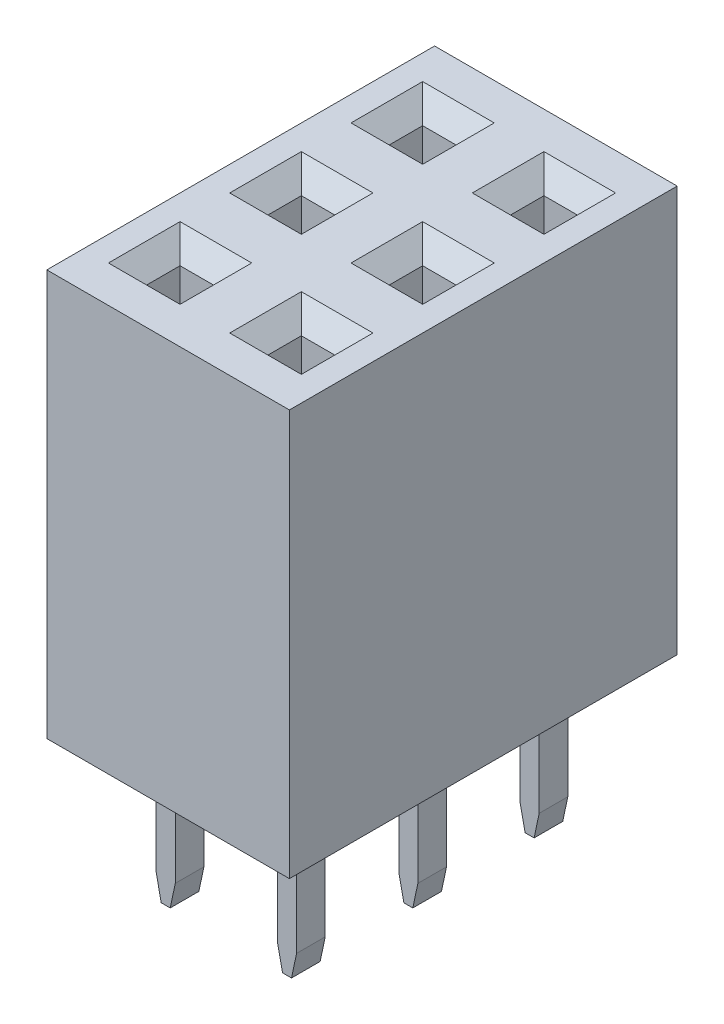
from build123d import *
from OCP.BRepFilletAPI import BRepFilletAPI_MakeChamfer

# Parameters (mm, degrees)
EXTRUDE_1_DEPTH                     = 8.5
SKETCH_4_W                          = 0.7
SKETCH_4_H                          = 0.7
CUT_EXTRUDE_1_DEPTH                 = 8.2
CHAMFER_3_SIZE                      = 0.4
SKETCH_2_W                          = 0.4
SKETCH_2_H                          = 0.6
EXTRUDE_2_DEPTH                     = 3
CHAMFER_2_SIZE                      = 0.5
CHAMFER_2_SIZE2                     = 0.106278281
PATTERN_LINEAR_1_COUNT              = 3
PATTERN_LINEAR_1_PITCH              = 2.54
PATTERN_LINEAR_1_COUNT_DIR2         = 2
PATTERN_LINEAR_1_PITCH_DIR2         = 2.54
CHAMFER_3_OF_PATTERN_LINEAR_1_SIZE  = 0.4
CHAMFER_2_OF_PATTERN_LINEAR_1_SIZE  = 0.5
CHAMFER_2_OF_PATTERN_LINEAR_1_SIZE2 = 0.106278281


with BuildPart() as part:
    # Эскиз1 → Бобышка-Вытянуть1 (new body)
    with BuildSketch(Plane(origin=(0, 0, 0), x_dir=(-1, 0, 0), z_dir=(0, 1, 0))):
        Polygon((-1.27, 1.52), (1.27, 1.52), (3.81, 1.52), (3.81, -1.52), (3.81, -6.6), (-1.27, -6.6), (-1.27, -1.52), align=None)
    extrude(amount=EXTRUDE_1_DEPTH)

    # Эскиз4 → Вырез-Вытянуть1 (cut)
    with BuildSketch(Plane(origin=(0, 8.5, 0), x_dir=(1, 0, 0), z_dir=(0, 1, 0))):
        Rectangle(SKETCH_4_W, SKETCH_4_H)
    cut_extrude_1 = extrude(amount=-CUT_EXTRUDE_1_DEPTH, mode=Mode.SUBTRACT)

    # Фаска3
    chamfer_3_edges = [part.edges().sort_by_distance(p)[0] for p in [
        (-0.35, 8.5, 0),
        (0, 8.5, 0.35),
        (0.35, 8.5, 0),
        (0, 8.5, -0.35),
    ]]
    chamfer(chamfer_3_edges, length=CHAMFER_3_SIZE)

    # Эскиз2 → Бобышка-Вытянуть2 (add)
    with BuildSketch(Plane(origin=(0, 0, 0), x_dir=(-1, 0, 0), z_dir=(0, 1, 0))):
        Rectangle(SKETCH_2_W, SKETCH_2_H)
    extrude_2 = extrude(amount=-EXTRUDE_2_DEPTH)

    # Фаска2: one chamfer whose edges measure the first distance from different faces: ONE call of the kernel's chamfer builder (chamfer() names one face for all edges)
    chamfer_2_edges_1 = [part.edges().sort_by_distance(p)[0] for p in [
        (-0.2, -3, 0),
    ]]
    chamfer_2_side_1 = [part.faces().sort_by_distance(p)[0] for p in [
        (-0.2, -1.5, 0),
    ]]
    chamfer_2_edges_2 = [part.edges().sort_by_distance(p)[0] for p in [
        (0.2, -3, 0),
    ]]
    chamfer_2_side_2 = [part.faces().sort_by_distance(p)[0] for p in [
        (0.2, -1.5, 0),
    ]]
    chamfer_2 = BRepFilletAPI_MakeChamfer(part.part.solid().wrapped)
    for e in chamfer_2_edges_1:
        chamfer_2.Add(CHAMFER_2_SIZE, CHAMFER_2_SIZE2, e.wrapped, chamfer_2_side_1[0].wrapped)  # the first distance lies on this face
    for e in chamfer_2_edges_2:
        chamfer_2.Add(CHAMFER_2_SIZE, CHAMFER_2_SIZE2, e.wrapped, chamfer_2_side_2[0].wrapped)  # the first distance lies on this face
    add(Compound.cast(chamfer_2.Shape()), mode=Mode.REPLACE)

    # Линейный массив1: Вырез-Вытянуть1, Extrude 2 3 × 2
    with Locations(*[(-j * PATTERN_LINEAR_1_PITCH_DIR2, 0, -i * PATTERN_LINEAR_1_PITCH) for i in range(PATTERN_LINEAR_1_COUNT) for j in range(PATTERN_LINEAR_1_COUNT_DIR2) if (i, j) != (0, 0)]):
        add(cut_extrude_1, mode=Mode.SUBTRACT)
        add(extrude_2)

    # Фаска3 of Линейный массив1
    chamfer_3_of_pattern_linear_1_edges = [part.edges().sort_by_distance(p)[0] for p in [
        (-2.89, 8.5, 0),
        (-2.54, 8.5, 0.35),
        (-2.19, 8.5, 0),
        (-2.54, 8.5, -0.35),
        (-0.35, 8.5, -2.54),
        (0, 8.5, -2.19),
        (0.35, 8.5, -2.54),
        (0, 8.5, -2.89),
        (-2.89, 8.5, -2.54),
        (-2.54, 8.5, -2.19),
        (-2.19, 8.5, -2.54),
        (-2.54, 8.5, -2.89),
        (-0.35, 8.5, -5.08),
        (0, 8.5, -4.73),
        (0.35, 8.5, -5.08),
        (0, 8.5, -5.43),
        (-2.89, 8.5, -5.08),
        (-2.54, 8.5, -4.73),
        (-2.19, 8.5, -5.08),
        (-2.54, 8.5, -5.43),
    ]]
    chamfer(chamfer_3_of_pattern_linear_1_edges, length=CHAMFER_3_OF_PATTERN_LINEAR_1_SIZE)

    # Фаска2 of Линейный массив1: one chamfer whose edges measure the first distance from different faces: ONE call of the kernel's chamfer builder (chamfer() names one face for all edges)
    chamfer_2_of_pattern_linear_1_edges_1 = [part.edges().sort_by_distance(p)[0] for p in [
        (-2.74, -3, 0),
    ]]
    chamfer_2_of_pattern_linear_1_side_1 = [part.faces().sort_by_distance(p)[0] for p in [
        (-2.74, -1.5, 0),
    ]]
    chamfer_2_of_pattern_linear_1_edges_2 = [part.edges().sort_by_distance(p)[0] for p in [
        (-2.34, -3, 0),
    ]]
    chamfer_2_of_pattern_linear_1_side_2 = [part.faces().sort_by_distance(p)[0] for p in [
        (-2.34, -1.5, 0),
    ]]
    chamfer_2_of_pattern_linear_1_edges_3 = [part.edges().sort_by_distance(p)[0] for p in [
        (-0.2, -3, -2.54),
    ]]
    chamfer_2_of_pattern_linear_1_side_3 = [part.faces().sort_by_distance(p)[0] for p in [
        (-0.2, -1.5, -2.54),
    ]]
    chamfer_2_of_pattern_linear_1_edges_4 = [part.edges().sort_by_distance(p)[0] for p in [
        (0.2, -3, -2.54),
    ]]
    chamfer_2_of_pattern_linear_1_side_4 = [part.faces().sort_by_distance(p)[0] for p in [
        (0.2, -1.5, -2.54),
    ]]
    chamfer_2_of_pattern_linear_1_edges_5 = [part.edges().sort_by_distance(p)[0] for p in [
        (-2.74, -3, -2.54),
    ]]
    chamfer_2_of_pattern_linear_1_side_5 = [part.faces().sort_by_distance(p)[0] for p in [
        (-2.74, -1.5, -2.54),
    ]]
    chamfer_2_of_pattern_linear_1_edges_6 = [part.edges().sort_by_distance(p)[0] for p in [
        (-2.34, -3, -2.54),
    ]]
    chamfer_2_of_pattern_linear_1_side_6 = [part.faces().sort_by_distance(p)[0] for p in [
        (-2.34, -1.5, -2.54),
    ]]
    chamfer_2_of_pattern_linear_1_edges_7 = [part.edges().sort_by_distance(p)[0] for p in [
        (-0.2, -3, -5.08),
    ]]
    chamfer_2_of_pattern_linear_1_side_7 = [part.faces().sort_by_distance(p)[0] for p in [
        (-0.2, -1.5, -5.08),
    ]]
    chamfer_2_of_pattern_linear_1_edges_8 = [part.edges().sort_by_distance(p)[0] for p in [
        (0.2, -3, -5.08),
    ]]
    chamfer_2_of_pattern_linear_1_side_8 = [part.faces().sort_by_distance(p)[0] for p in [
        (0.2, -1.5, -5.08),
    ]]
    chamfer_2_of_pattern_linear_1_edges_9 = [part.edges().sort_by_distance(p)[0] for p in [
        (-2.74, -3, -5.08),
    ]]
    chamfer_2_of_pattern_linear_1_side_9 = [part.faces().sort_by_distance(p)[0] for p in [
        (-2.74, -1.5, -5.08),
    ]]
    chamfer_2_of_pattern_linear_1_edges_10 = [part.edges().sort_by_distance(p)[0] for p in [
        (-2.34, -3, -5.08),
    ]]
    chamfer_2_of_pattern_linear_1_side_10 = [part.faces().sort_by_distance(p)[0] for p in [
        (-2.34, -1.5, -5.08),
    ]]
    chamfer_2_of_pattern_linear_1 = BRepFilletAPI_MakeChamfer(part.part.solid().wrapped)
    for e in chamfer_2_of_pattern_linear_1_edges_1:
        chamfer_2_of_pattern_linear_1.Add(CHAMFER_2_OF_PATTERN_LINEAR_1_SIZE, CHAMFER_2_OF_PATTERN_LINEAR_1_SIZE2, e.wrapped, chamfer_2_of_pattern_linear_1_side_1[0].wrapped)  # the first distance lies on this face
    for e in chamfer_2_of_pattern_linear_1_edges_2:
        chamfer_2_of_pattern_linear_1.Add(CHAMFER_2_OF_PATTERN_LINEAR_1_SIZE, CHAMFER_2_OF_PATTERN_LINEAR_1_SIZE2, e.wrapped, chamfer_2_of_pattern_linear_1_side_2[0].wrapped)  # the first distance lies on this face
    for e in chamfer_2_of_pattern_linear_1_edges_3:
        chamfer_2_of_pattern_linear_1.Add(CHAMFER_2_OF_PATTERN_LINEAR_1_SIZE, CHAMFER_2_OF_PATTERN_LINEAR_1_SIZE2, e.wrapped, chamfer_2_of_pattern_linear_1_side_3[0].wrapped)  # the first distance lies on this face
    for e in chamfer_2_of_pattern_linear_1_edges_4:
        chamfer_2_of_pattern_linear_1.Add(CHAMFER_2_OF_PATTERN_LINEAR_1_SIZE, CHAMFER_2_OF_PATTERN_LINEAR_1_SIZE2, e.wrapped, chamfer_2_of_pattern_linear_1_side_4[0].wrapped)  # the first distance lies on this face
    for e in chamfer_2_of_pattern_linear_1_edges_5:
        chamfer_2_of_pattern_linear_1.Add(CHAMFER_2_OF_PATTERN_LINEAR_1_SIZE, CHAMFER_2_OF_PATTERN_LINEAR_1_SIZE2, e.wrapped, chamfer_2_of_pattern_linear_1_side_5[0].wrapped)  # the first distance lies on this face
    for e in chamfer_2_of_pattern_linear_1_edges_6:
        chamfer_2_of_pattern_linear_1.Add(CHAMFER_2_OF_PATTERN_LINEAR_1_SIZE, CHAMFER_2_OF_PATTERN_LINEAR_1_SIZE2, e.wrapped, chamfer_2_of_pattern_linear_1_side_6[0].wrapped)  # the first distance lies on this face
    for e in chamfer_2_of_pattern_linear_1_edges_7:
        chamfer_2_of_pattern_linear_1.Add(CHAMFER_2_OF_PATTERN_LINEAR_1_SIZE, CHAMFER_2_OF_PATTERN_LINEAR_1_SIZE2, e.wrapped, chamfer_2_of_pattern_linear_1_side_7[0].wrapped)  # the first distance lies on this face
    for e in chamfer_2_of_pattern_linear_1_edges_8:
        chamfer_2_of_pattern_linear_1.Add(CHAMFER_2_OF_PATTERN_LINEAR_1_SIZE, CHAMFER_2_OF_PATTERN_LINEAR_1_SIZE2, e.wrapped, chamfer_2_of_pattern_linear_1_side_8[0].wrapped)  # the first distance lies on this face
    for e in chamfer_2_of_pattern_linear_1_edges_9:
        chamfer_2_of_pattern_linear_1.Add(CHAMFER_2_OF_PATTERN_LINEAR_1_SIZE, CHAMFER_2_OF_PATTERN_LINEAR_1_SIZE2, e.wrapped, chamfer_2_of_pattern_linear_1_side_9[0].wrapped)  # the first distance lies on this face
    for e in chamfer_2_of_pattern_linear_1_edges_10:
        chamfer_2_of_pattern_linear_1.Add(CHAMFER_2_OF_PATTERN_LINEAR_1_SIZE, CHAMFER_2_OF_PATTERN_LINEAR_1_SIZE2, e.wrapped, chamfer_2_of_pattern_linear_1_side_10[0].wrapped)  # the first distance lies on this face
    add(Compound.cast(chamfer_2_of_pattern_linear_1.Shape()), mode=Mode.REPLACE)


solid = part.part
